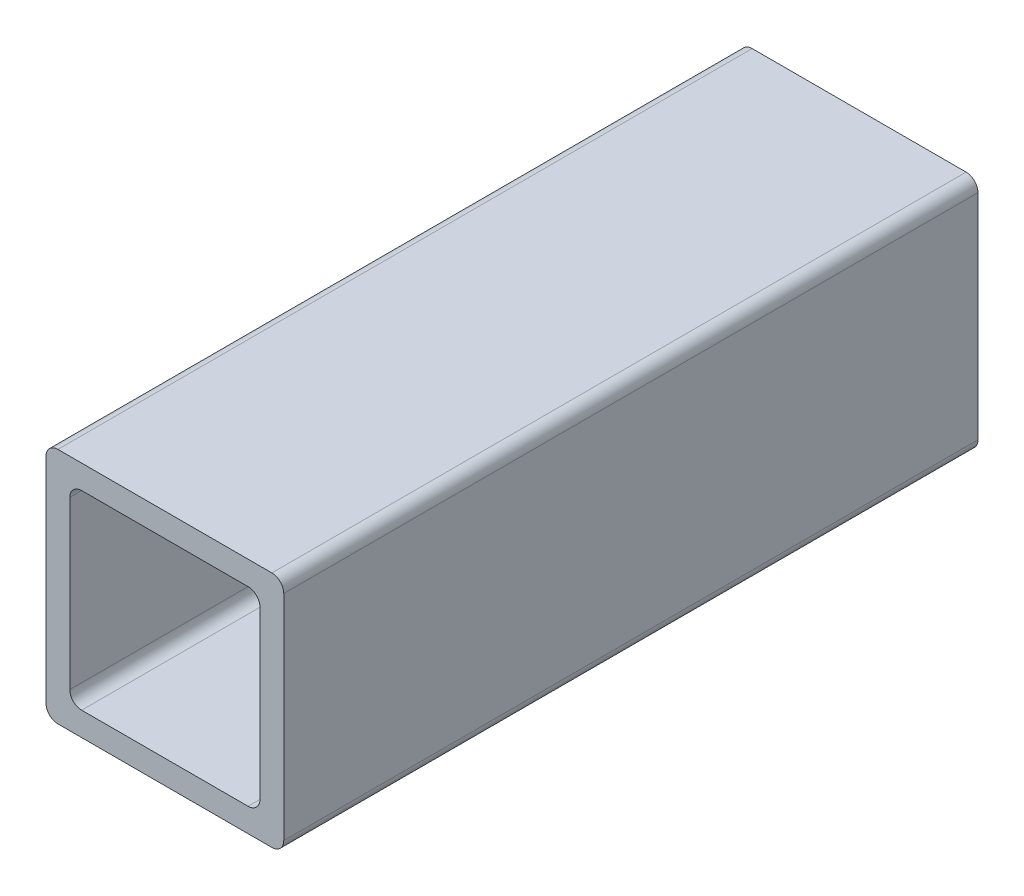
from build123d import *

# Parameters (mm, degrees)
SKETCH1_W           = 25.4
SKETCH1_H           = 25.4
SKETCH1_W_2         = 20.32
SKETCH1_H_2         = 20.32
BOSS_EXTRUDE2_DEPTH = 74.168
FILLET1_R           = 1.27


with BuildPart() as part:
    # Sketch1 → Boss-Extrude2 (new body)
    with BuildSketch(Plane.XY.offset(-3.048)):
        Rectangle(SKETCH1_W, SKETCH1_H)
        Rectangle(SKETCH1_W_2, SKETCH1_H_2, mode=Mode.SUBTRACT)
    extrude(amount=BOSS_EXTRUDE2_DEPTH)

    # Fillet1
    fillet1_edges = [part.edges().sort_by_distance(p)[0] for p in [
        (-12.7, 12.7, 34.036),
        (-12.7, -12.7, 34.036),
        (12.7, -12.7, 34.036),
        (12.7, 12.7, 34.036),
        (-10.16, -10.16, 34.036),
        (10.16, -10.16, 34.036),
        (10.16, 10.16, 34.036),
        (-10.16, 10.16, 34.036),
    ]]
    fillet(fillet1_edges, radius=FILLET1_R)


solid = part.part
